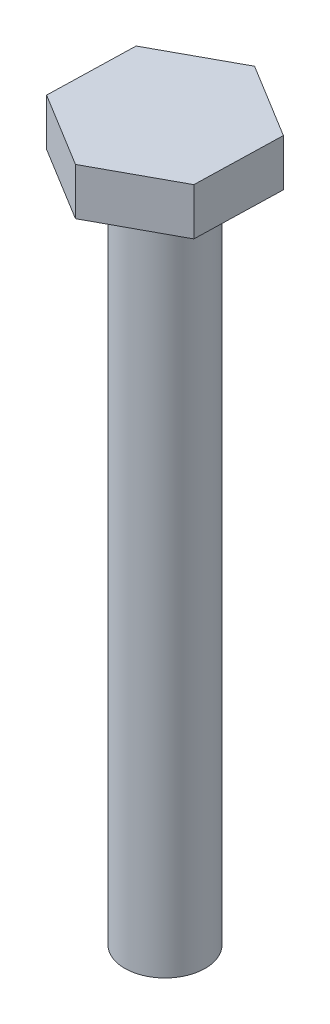
from build123d import *

# Parameters (mm, degrees)
BOSS_EXTRUDE1_DEPTH = 3.5
SKETCH2_R           = 3
BOSS_EXTRUDE2_DEPTH = 50


with BuildPart() as part:
    # Sketch1 → Boss-Extrude1 (new body)
    with BuildSketch(Plane(origin=(0, 0, 0), x_dir=(1, 0, 0), z_dir=(0, 1, 0))):
        Polygon((5.543350936, -3.394298218), (5.711223953, 3.103533624), (0.167873017, 6.497831842), (-5.543350936, 3.394298218), (-5.711223953, -3.103533624), (-0.167873017, -6.497831842), align=None)
    extrude(amount=BOSS_EXTRUDE1_DEPTH)

    # Sketch2 → Boss-Extrude2 (add)
    with BuildSketch(Plane.XZ):
        with Locations(Location((0, 0, 0), (0, 0, 90))):
            Circle(SKETCH2_R)
    extrude(amount=BOSS_EXTRUDE2_DEPTH)


solid = part.part
